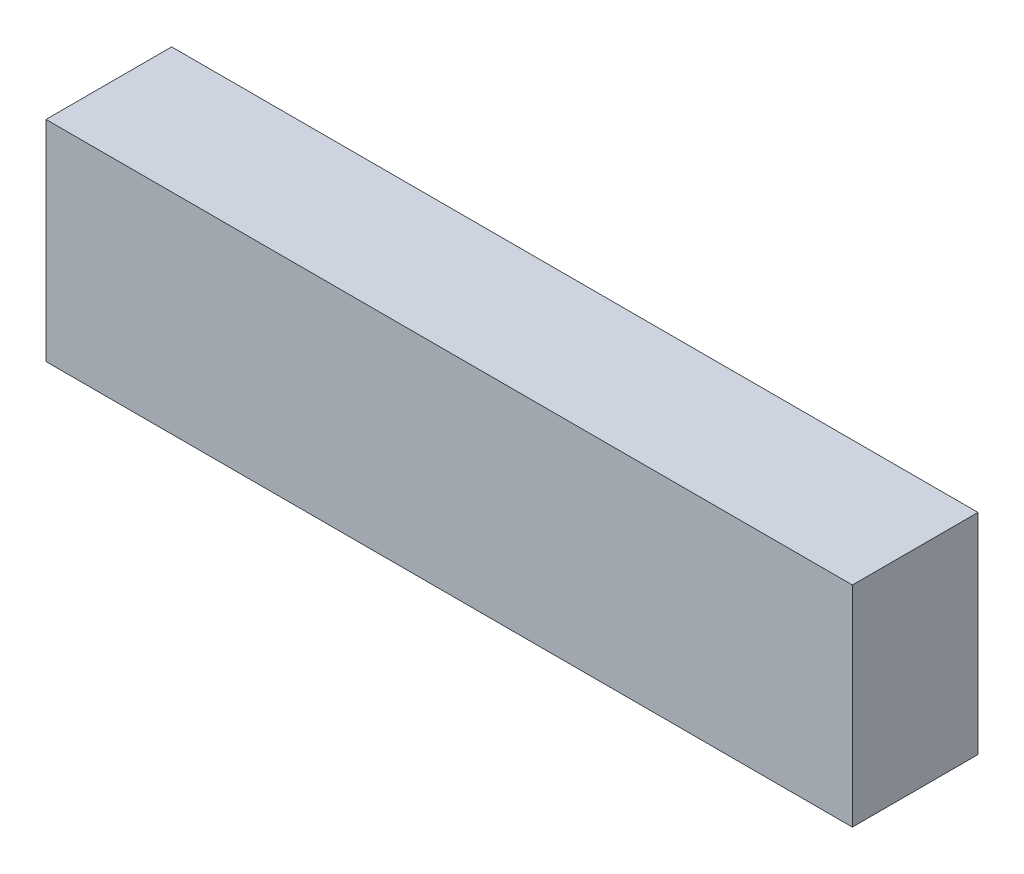
from build123d import *

# Parameters (mm, degrees)
SKETCH1_W                 = 46.53230149
SKETCH1_H                 = 12.101430126
BOSS_EXTRUDE1_DEPTH       = 7.25
SHELL1_T                  = -0.5
SHELL1_THICKNESS_2_FACE_W = 45.53230149
SHELL1_THICKNESS_2_FACE_H = 11.101430126
SHELL1_THICKNESS_2_DEPTH  = 0.3


with BuildPart() as part:
    # Sketch1 → Boss-Extrude1 (new body)
    with BuildSketch(Plane.XY):
        with Locations((55.770650745, 71.520715063)):
            Rectangle(SKETCH1_W, SKETCH1_H)
    extrude(amount=BOSS_EXTRUDE1_DEPTH)

    # Shell1
    shell1_openings = [part.faces().sort_by_distance(p)[0] for p in [
        (55.770650745, 71.520715063, 0),
    ]]
    offset(amount=SHELL1_T, openings=shell1_openings, kind=Kind.INTERSECTION)

    # Shell1 thickness 2 face (on inner face of the shell) → Shell1 thickness 2 (cut)
    with BuildSketch(Plane(origin=(55.770650745, 71.520715063, 6.75), x_dir=(1, 0, 0), z_dir=(0, 0, 1))):
        Rectangle(SHELL1_THICKNESS_2_FACE_W, SHELL1_THICKNESS_2_FACE_H)
    extrude(amount=SHELL1_THICKNESS_2_DEPTH, mode=Mode.SUBTRACT)


solid = part.part
